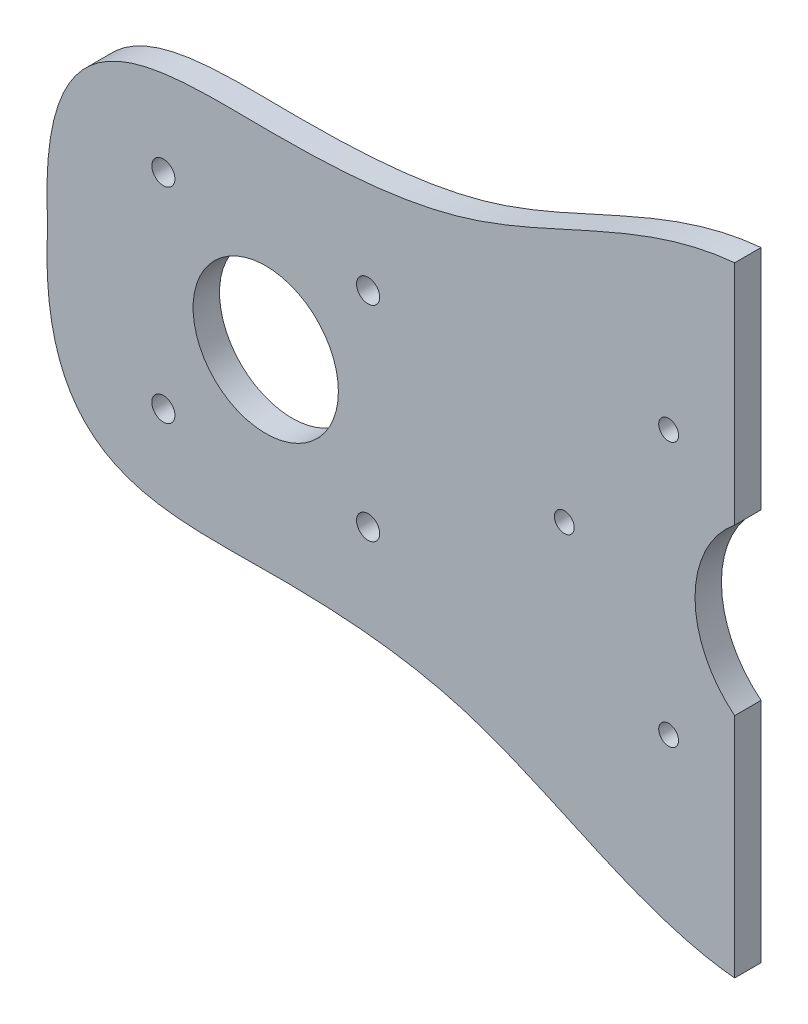
from build123d import *

# Parameters (mm, degrees)
SKETCH1_R           = 1.75
SKETCH1_R_2         = 11
SKETCH1_R_3         = 1.5
BOSS_EXTRUDE1_DEPTH = 4


with BuildPart() as part:
    # Sketch1 → Boss-Extrude1 (new body)
    with BuildSketch(Plane.XY):
        with BuildLine():
            Line((-10, -12.489995997), (-10, -46.892440974))
            add(Edge.make_bspline(
                [(-10, -46.892440974), (-14.369218745, -46.490133027), (-28.167584564, -42.861139713), (-50.099896224, -30.060662438), (-86.961390459, -27.922716714), (-115.783330075, -30.807532602), (-114.008518426, 0)],
                knots=[0.072781672, 0.072781672, 0.072781672, 0.072781672, 0.171379313, 0.397323978, 0.628335943, 1, 1, 1, 1], degree=3))
            add(Edge.make_bspline(
                [(-10, 46.892440974), (-14.369218745, 46.490133027), (-28.167584564, 42.861139713), (-50.099896224, 30.060662438), (-86.961390459, 27.922716714), (-115.783330075, 30.807532602), (-114.008518426, 0)],
                knots=[0.072781672, 0.072781672, 0.072781672, 0.072781672, 0.171379313, 0.397323978, 0.628335943, 1, 1, 1, 1], degree=3))
            Line((-10, 46.892440974), (-10, 12.489995997))
            ThreePointArc((-10, 12.489995997), (-16, 0), (-10, -12.489995997))
        make_face()
        with Locations((-96.5, 15.5)):
            Circle(SKETCH1_R, mode=Mode.SUBTRACT)
        with Locations((-65.5, 15.5)):
            Circle(SKETCH1_R, mode=Mode.SUBTRACT)
        with Locations(Location((-65.5, -15.5, 0), (0, 0, 180))):
            Circle(SKETCH1_R, mode=Mode.SUBTRACT)
        with Locations(Location((-96.5, -15.5, 0), (0, 0, 180))):
            Circle(SKETCH1_R, mode=Mode.SUBTRACT)
        with Locations((-81, 0)):
            Circle(SKETCH1_R_2, mode=Mode.SUBTRACT)
        with Locations((-35.787805635, 0)):
            Circle(SKETCH1_R_3, mode=Mode.SUBTRACT)
        with Locations((-20, 20)):
            Circle(SKETCH1_R_3, mode=Mode.SUBTRACT)
        with Locations(Location((-20, -20, 0), (0, 0, 180))):
            Circle(SKETCH1_R_3, mode=Mode.SUBTRACT)
    extrude(amount=BOSS_EXTRUDE1_DEPTH)


solid = part.part
